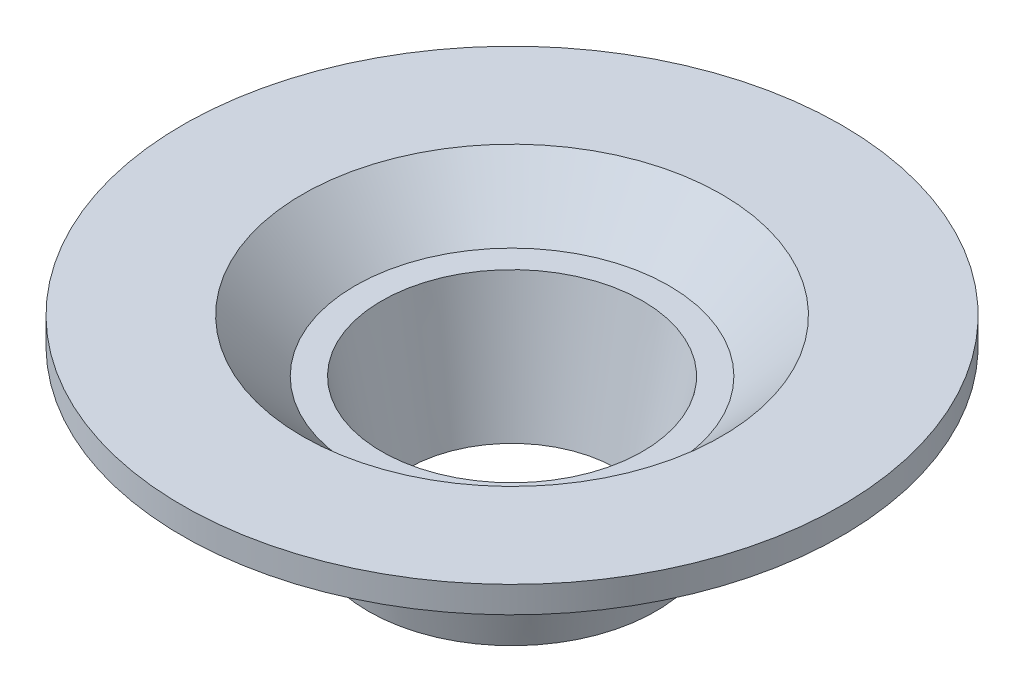
from build123d import *


with BuildPart() as part:
    # Sketch1 → Revolve1 (revolve)
    with BuildSketch(Plane.XY, mode=Mode.PRIVATE) as revolve1_sk:
        Polygon((4.95, 5), (5.95, 5), (7.95, 7), (12.5, 7), (12.5, 6), (10.5, 6), (8.5, 4), (6.25, 4), (5.45, 0), (3.95, 0), align=None)
    revolve(revolve1_sk.sketch.rotate(Axis((0, 0, 0), (0, 1, 0)), 90), axis=Axis((0, 0, 0), (0, 1, 0)))


solid = part.part
